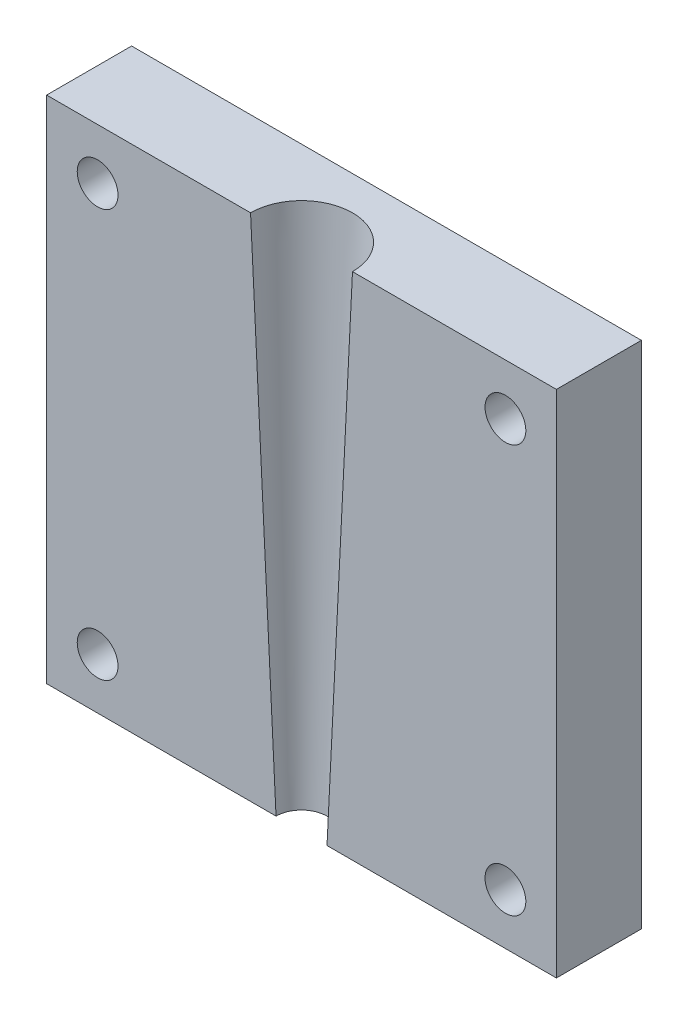
from build123d import *

# Parameters (mm, degrees)
SKETCH1_W                                        = 30
SKETCH1_H                                        = 30
BOSS_EXTRUDE1_DEPTH                              = 5
CBORE_FOR_M2_PAN_HEAD_MACHINE_SCREW1_D           = 2.4
CBORE_FOR_M2_PAN_HEAD_MACHINE_SCREW1_CBORE_D     = 5
CBORE_FOR_M2_PAN_HEAD_MACHINE_SCREW1_CBORE_DEPTH = 1.6


with BuildPart() as part:
    # Sketch1 → Boss-Extrude1 (new body)
    with BuildSketch(Plane.XY):
        with Locations((15, -15)):
            Rectangle(SKETCH1_W, SKETCH1_H)
    extrude(amount=BOSS_EXTRUDE1_DEPTH)

    # Sketch2 → Cut-Loft1 section 0
    with BuildSketch(Plane(origin=(0, 0, 0), x_dir=(1, 0, 0), z_dir=(0, 1, 0))):
        with BuildLine():
            Line((12, -5), (18, -5))
            ThreePointArc((18, -5), (15, -2), (12, -5))
        make_face()
    # Sketch3 → Cut-Loft1 section 1
    with BuildSketch(Plane.XZ.offset(30)):
        with BuildLine():
            Line((13.5, 5), (16.5, 5))
            ThreePointArc((16.5, 5), (15, 3.5), (13.5, 5))
        make_face()
    loft(mode=Mode.SUBTRACT)

    # CBORE for M2 Pan Head Machine Screw1 (through all)
    with Locations(Plane(origin=(0, 0, 0), x_dir=(-1, 0, 0), z_dir=(0, 0, -1))):
        with Locations((-27, -3), (-3, -3), (-3, -27), (-27, -27)):
            CounterBoreHole(CBORE_FOR_M2_PAN_HEAD_MACHINE_SCREW1_D / 2, CBORE_FOR_M2_PAN_HEAD_MACHINE_SCREW1_CBORE_D / 2, CBORE_FOR_M2_PAN_HEAD_MACHINE_SCREW1_CBORE_DEPTH)


solid = part.part
